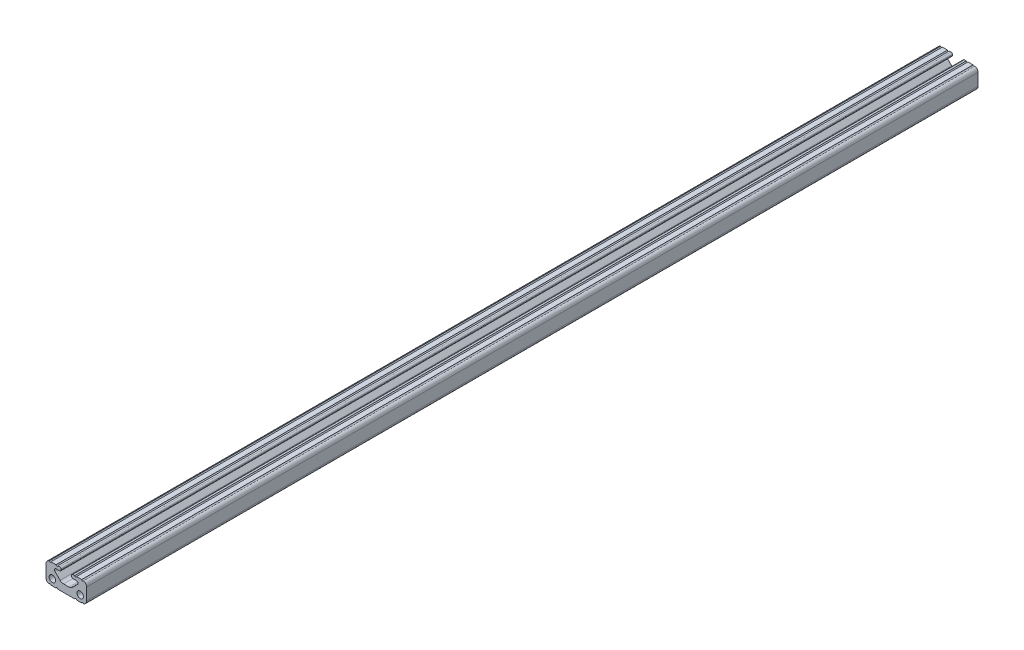
from build123d import *

# Parameters (mm, degrees)
SKETCH3_R               = 2.032
BOSS_EXTRUDE1_DEPTH     = 304.8
CUT_EXTRUDE1_DEPTH      = 306.130549929
CUT_EXTRUDE1_DEPTH_BACK = 306.130549929
SKETCH4_R               = 0.55245
CUT_EXTRUDE2_DEPTH      = 50.8


with BuildPart() as part:
    # Sketch3 → Boss-Extrude1 (new, symmetric)
    with BuildSketch(Plane.XY):
        with BuildLine():
            Line((3.2512, 5.35559), (3.2512, 5.13461))
            ThreePointArc((3.2512, 5.13461), (3.542455946, 4.431455946), (4.24561, 4.1402))
            Line((4.24561, 4.1402), (6.42239, 4.1402))
            ThreePointArc((6.42239, 4.1402), (7.341105046, 3.526334232), (7.125544054, 2.442635946))
            Line((7.125544054, 2.442635946), (3.854875946, -0.828032163))
            ThreePointArc((3.854875946, -0.828032163), (2.887046479, -1.474715138), (1.745413783, -1.7018))
            Line((1.745413783, -1.7018), (0, -1.7018))
            Line((0, -1.7018), (0, -6.35))
            Line((0, -6.35), (10.16, -6.35))
            ThreePointArc((10.16, -6.35), (11.956051224, -5.606051224), (12.7, -3.81))
            Line((12.7, -3.81), (12.7, 3.81))
            ThreePointArc((12.7, 3.81), (11.956051224, 5.606051224), (10.16, 6.35))
            Line((10.16, 6.35), (4.24561, 6.35))
            ThreePointArc((4.24561, 6.35), (3.542455946, 6.058744054), (3.2512, 5.35559))
        make_face()
        with Locations(Location((8.7249, -2.3876, 0), (0, 0, 180))):
            Circle(SKETCH3_R, mode=Mode.SUBTRACT)
    extrude(amount=BOSS_EXTRUDE1_DEPTH, both=True)

    # Sketch4 → Cut-Extrude1 (cut, two sides: drawn at the far end of the back side and taken through both)
    with BuildSketch(Plane.XY.offset(-CUT_EXTRUDE1_DEPTH_BACK)):
        with Locations((5.86994, 6.35)):
            Circle(SKETCH4_R)
        with Locations((10.20445, 6.35)):
            Circle(SKETCH4_R)
        with Locations((5.86994, -6.35)):
            Circle(SKETCH4_R)
        with Locations((10.20445, -6.35)):
            Circle(SKETCH4_R)
    extrude(amount=CUT_EXTRUDE1_DEPTH + CUT_EXTRUDE1_DEPTH_BACK, mode=Mode.SUBTRACT)

    # Mirror1: part across plane


with BuildPart() as part_1:
    add(part.part)
    add(part.part.mirror(Plane(origin=(0, 0, 0), x_dir=(0, 0, 1), z_dir=(1, 0, 0))))

    # Sketch5 → Cut-Extrude2 (cut)
    with BuildSketch(Plane.XY.offset(304.8)):
        with BuildLine():
            Line((9.652, 6.35), (6.42239, 6.35))
            ThreePointArc((6.42239, 6.35), (5.86994, 5.79755), (5.31749, 6.35))
            Line((5.31749, 6.35), (4.24561, 6.35))
            ThreePointArc((4.24561, 6.35), (3.542455946, 6.058744054), (3.2512, 5.35559))
            Line((3.2512, 5.35559), (3.2512, 5.13461))
            ThreePointArc((3.2512, 5.13461), (3.542455946, 4.431455946), (4.24561, 4.1402))
            Line((4.24561, 4.1402), (6.42239, 4.1402))
            ThreePointArc((6.42239, 4.1402), (7.341105046, 3.526334232), (7.125544054, 2.442635946))
            Line((7.125544054, 2.442635946), (3.854875946, -0.828032163))
            ThreePointArc((3.854875946, -0.828032163), (2.887046479, -1.474715138), (1.745413783, -1.7018))
            Line((1.745413783, -1.7018), (-1.745413783, -1.7018))
            ThreePointArc((-1.745413783, -1.7018), (-2.887046479, -1.474715138), (-3.854875946, -0.828032163))
            Line((-3.854875946, -0.828032163), (-7.125544054, 2.442635946))
            ThreePointArc((-7.125544054, 2.442635946), (-7.341105046, 3.526334232), (-6.42239, 4.1402))
            Line((-6.42239, 4.1402), (-4.24561, 4.1402))
            ThreePointArc((-4.24561, 4.1402), (-3.542455946, 4.431455946), (-3.2512, 5.13461))
            Line((-3.2512, 5.13461), (-3.2512, 5.35559))
            ThreePointArc((-3.2512, 5.35559), (-3.542455946, 6.058744054), (-4.24561, 6.35))
            Line((-4.24561, 6.35), (-5.31749, 6.35))
            ThreePointArc((-5.31749, 6.35), (-5.86994, 5.79755), (-6.42239, 6.35))
            Line((-6.42239, 6.35), (-9.652, 6.35))
            ThreePointArc((-9.652, 6.35), (-10.169350236, 5.798666155), (-10.752439892, 6.279942302))
            ThreePointArc((-10.752439892, 6.279942302), (-12.154542219, 5.382705102), (-12.7, 3.81))
            Line((-12.7, 3.81), (-12.7, -3.81))
            ThreePointArc((-12.7, -3.81), (-12.154542219, -5.382705102), (-10.752439892, -6.279942302))
            ThreePointArc((-10.752439892, -6.279942302), (-10.169350236, -5.798666155), (-9.652, -6.35))
            Line((-9.652, -6.35), (-6.42239, -6.35))
            ThreePointArc((-6.42239, -6.35), (-5.86994, -5.79755), (-5.31749, -6.35))
            Line((-5.31749, -6.35), (5.31749, -6.35))
            ThreePointArc((5.31749, -6.35), (5.86994, -5.79755), (6.42239, -6.35))
            Line((6.42239, -6.35), (9.652, -6.35))
            ThreePointArc((9.652, -6.35), (10.169350236, -5.798666155), (10.752439892, -6.279942302))
            ThreePointArc((10.752439892, -6.279942302), (12.154542219, -5.382705102), (12.7, -3.81))
            Line((12.7, -3.81), (12.7, 3.81))
            ThreePointArc((12.7, 3.81), (12.154542219, 5.382705102), (10.752439892, 6.279942302))
            ThreePointArc((10.752439892, 6.279942302), (10.169350236, 5.798666155), (9.652, 6.35))
        make_face()
    extrude(amount=-CUT_EXTRUDE2_DEPTH, mode=Mode.SUBTRACT)


solid = part_1.part
